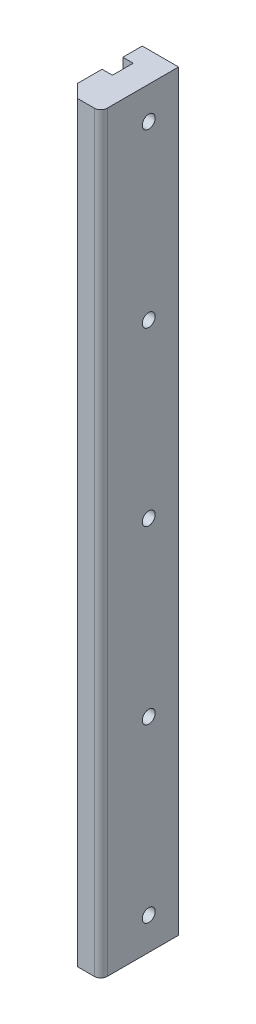
from build123d import *

# Parameters (mm, degrees)
BOSS_EXTRUDE1_DEPTH = 580
SKETCH2_R           = 5
CUT_EXTRUDE1_DEPTH  = 580
SKETCH4_R           = 5
CUT_EXTRUDE2_DEPTH  = 580
SKETCH5_R           = 5
CUT_EXTRUDE3_DEPTH  = 580
SKETCH6_R           = 5
CUT_EXTRUDE4_DEPTH  = 580
SKETCH7_R           = 5
CUT_EXTRUDE5_DEPTH  = 580
FILLET3_R           = 5


with BuildPart() as part:
    # Sketch1 → Boss-Extrude1 (new body)
    with BuildSketch(Plane(origin=(0, 0, 0), x_dir=(1, 0, 0), z_dir=(0, 1, 0))):
        Polygon((0, 0), (0, 60), (-28, 60), (-28, 45), (-20, 45), (-20, 29), (-28, 29), (-28, 10), (-18, 0), align=None)
    extrude(amount=BOSS_EXTRUDE1_DEPTH)

    # Sketch2 → Cut-Extrude1 (cut)
    with BuildSketch(Plane(origin=(0, 0, 0), x_dir=(0, 0, -1), z_dir=(1, 0, 0))):
        with Locations((37, 25)):
            Circle(SKETCH2_R)
    extrude(amount=-CUT_EXTRUDE1_DEPTH, mode=Mode.SUBTRACT)

    # Sketch4 → Cut-Extrude2 (cut)
    with BuildSketch(Plane.ZY.offset(20)):
        with Locations((-37, 157.5)):
            Circle(SKETCH4_R)
    extrude(amount=-CUT_EXTRUDE2_DEPTH, mode=Mode.SUBTRACT)

    # Sketch5 → Cut-Extrude3 (cut)
    with BuildSketch(Plane(origin=(0, 0, 0), x_dir=(0, 0, -1), z_dir=(1, 0, 0))):
        with Locations((37, 290)):
            Circle(SKETCH5_R)
    extrude(amount=-CUT_EXTRUDE3_DEPTH, mode=Mode.SUBTRACT)

    # Sketch6 → Cut-Extrude4 (cut)
    with BuildSketch(Plane(origin=(0, 0, 0), x_dir=(0, 0, -1), z_dir=(1, 0, 0))):
        with Locations((37, 422.5)):
            Circle(SKETCH6_R)
    extrude(amount=-CUT_EXTRUDE4_DEPTH, mode=Mode.SUBTRACT)

    # Sketch7 → Cut-Extrude5 (cut)
    with BuildSketch(Plane(origin=(0, 0, 0), x_dir=(0, 0, -1), z_dir=(1, 0, 0))):
        with Locations((37, 555)):
            Circle(SKETCH7_R)
    extrude(amount=-CUT_EXTRUDE5_DEPTH, mode=Mode.SUBTRACT)

    # Fillet3
    fillet3_edges = [part.edges().sort_by_distance(p)[0] for p in [
        (0, 290, 0),
    ]]
    fillet(fillet3_edges, radius=FILLET3_R)


solid = part.part
